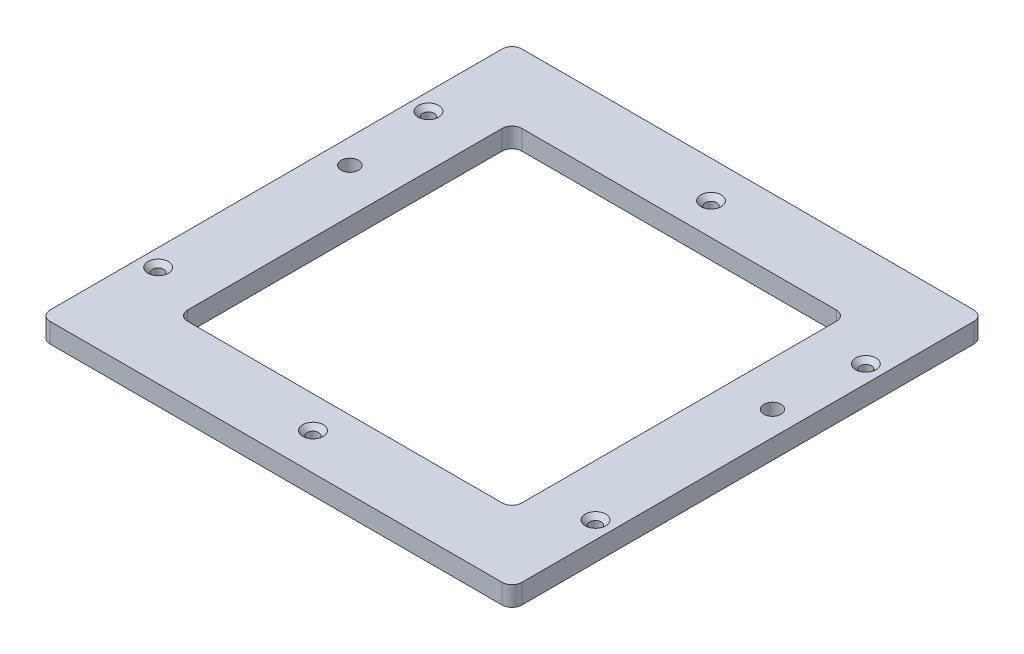
from build123d import *

# Parameters (mm, degrees)
SKETCH1_W                                       = 240
SKETCH1_H                                       = 240
BOSS_EXTRUDE1_DEPTH                             = 10
CSK_FOR_M5_FLAT_HEAD_MACHINE_SCREW1_D           = 5.8
CSK_FOR_M5_FLAT_HEAD_MACHINE_SCREW1_CSINK_D     = 10.4
CSK_FOR_M5_FLAT_HEAD_MACHINE_SCREW1_CSINK_ANGLE = 90
FILLET1_R                                       = 5
TAP_DRILL_FOR_M10X1_25_TAP1_D                   = 8.8
TAP_DRILL_FOR_M10X1_25_TAP1_DEPTH               = 19.75
TAP_DRILL_FOR_M10X1_25_TAP1_TIP                 = 2.643786724
SKETCH8_W                                       = 170
SKETCH8_H                                       = 170
CUT_EXTRUDE1_DEPTH                              = 10
FILLET2_R                                       = 5


with BuildPart() as part:
    # Sketch1 → Boss-Extrude1 (new body)
    with BuildSketch(Plane(origin=(0, 0, 0), x_dir=(1, 0, 0), z_dir=(0, 1, 0))):
        Rectangle(SKETCH1_W, SKETCH1_H)
    extrude(amount=BOSS_EXTRUDE1_DEPTH)

    # CSK for M5 Flat Head Machine Screw1 (through all)
    with Locations(Plane(origin=(0, 10, 0), x_dir=(1, 0, 0), z_dir=(0, 1, 0))):
        with Locations((-111.25, 68.75), (0, 101.25), (111.25, 68.75), (111.25, -68.75), (0, -101.25), (-111.25, -68.75)):
            CounterSinkHole(CSK_FOR_M5_FLAT_HEAD_MACHINE_SCREW1_D / 2, CSK_FOR_M5_FLAT_HEAD_MACHINE_SCREW1_CSINK_D / 2, counter_sink_angle=CSK_FOR_M5_FLAT_HEAD_MACHINE_SCREW1_CSINK_ANGLE)

    # Fillet1
    fillet1_edges = [part.edges().sort_by_distance(p)[0] for p in [
        (120, 5, 120),
        (-120, 5, 120),
        (-120, 5, -120),
        (120, 5, -120),
    ]]
    fillet(fillet1_edges, radius=FILLET1_R)

    # Tap Drill for M10x1.25 Tap1
    with Locations(Plane(origin=(0, 10, 0), x_dir=(1, 0, 0), z_dir=(0, 1, 0))):
        with Locations((107.5, 25), (-107.5, 25)):
            Hole(TAP_DRILL_FOR_M10X1_25_TAP1_D / 2, depth=TAP_DRILL_FOR_M10X1_25_TAP1_DEPTH)
            with Locations((0, 0, -(TAP_DRILL_FOR_M10X1_25_TAP1_DEPTH + TAP_DRILL_FOR_M10X1_25_TAP1_TIP / 2))):  # 118° drill point
                Cone(0, TAP_DRILL_FOR_M10X1_25_TAP1_D / 2, TAP_DRILL_FOR_M10X1_25_TAP1_TIP, mode=Mode.SUBTRACT)

    # Sketch8 → Cut-Extrude1 (cut)
    with BuildSketch(Plane(origin=(0, 10, 0), x_dir=(1, 0, 0), z_dir=(0, 1, 0))):
        Rectangle(SKETCH8_W, SKETCH8_H)
    extrude(amount=-CUT_EXTRUDE1_DEPTH, mode=Mode.SUBTRACT)

    # Fillet2
    fillet2_edges = [part.edges().sort_by_distance(p)[0] for p in [
        (-85, 5, -85),
        (85, 5, -85),
        (85, 5, 85),
        (-85, 5, 85),
    ]]
    fillet(fillet2_edges, radius=FILLET2_R)


solid = part.part
